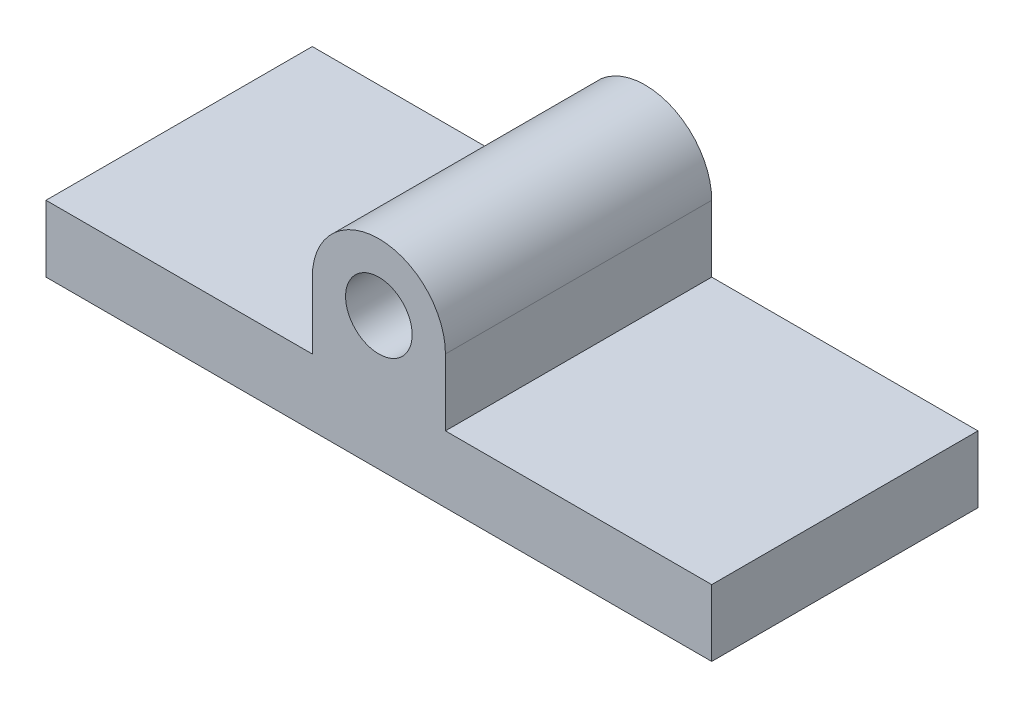
from build123d import *

# Parameters (mm, degrees)
SKETCH_1_W          = 50
SKETCH_1_H          = 5
EXTRUDE_1_DEPTH     = 20
EXTRUDE_2_DEPTH     = 20
SKETCH_3_R          = 2.5
CUT_EXTRUDE_1_DEPTH = 20


with BuildPart() as part:
    # 草图1 → 凸台-拉伸1 (new body)
    with BuildSketch(Plane.XY):
        with Locations((0, 2.5)):
            Rectangle(SKETCH_1_W, SKETCH_1_H)
    extrude(amount=EXTRUDE_1_DEPTH)

    # 草图2 → 凸台-拉伸2 (add)
    with BuildSketch(Plane.XY.offset(20)):
        with BuildLine():
            Line((-5, 10), (-5, 5))
            Line((-5, 5), (5, 5))
            Line((5, 5), (5, 10))
            ThreePointArc((5, 10), (0, 15), (-5, 10))
        make_face()
    extrude(amount=-EXTRUDE_2_DEPTH)

    # 草图3 → 切除-拉伸1 (cut)
    with BuildSketch(Plane.XY.offset(20)):
        with Locations((0, 10)):
            Circle(SKETCH_3_R)
    extrude(amount=-CUT_EXTRUDE_1_DEPTH, mode=Mode.SUBTRACT)


solid = part.part
